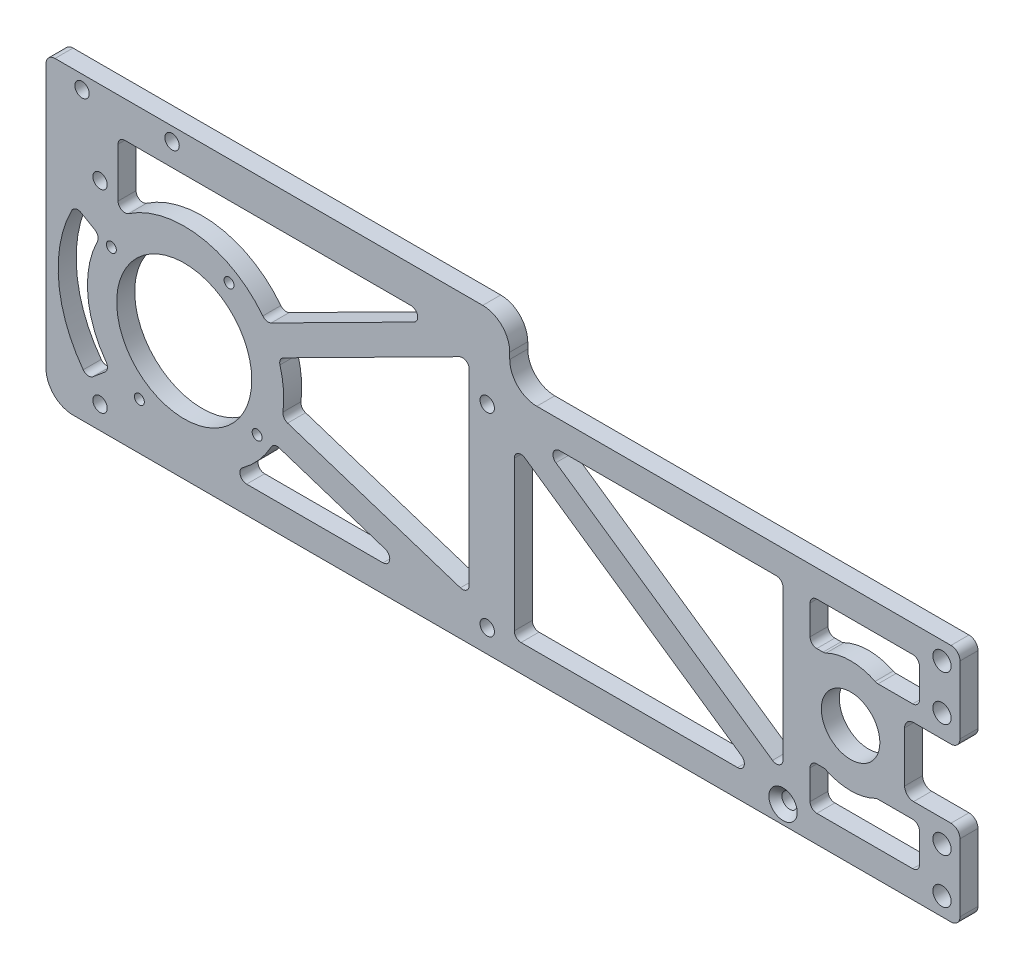
from build123d import *

# Parameters (mm, degrees)
SKETCH_1_W                   = 200
SKETCH_1_H                   = 53.2
SKETCH_1_R                   = 6.5
SKETCH_1_R_2                 = 2.025
EXTRUDE_1_DEPTH              = 2
SKETCH_2_R                   = 20
CUT_EXTRUDE_1_DEPTH          = 5
CUT_EXTRUDE_2_DEPTH          = 10
SKETCH_4_R                   = 1.1
CUT_EXTRUDE_3_DEPTH          = 10
SKETCH_5_W                   = 100
SKETCH_5_H                   = 13.4
SKETCH_5_R                   = 1.6
EXTRUDE_2_DEPTH              = 4
EXTRUDE_3_DEPTH              = 4
SKETCH_7_R                   = 1.1
SKETCH_7_R_2                 = 15
EXTRUDE_4_DEPTH              = 4
SKETCH_9_R                   = 1.1
CUT_EXTRUDE_4_DEPTH          = 10
SKETCH_11_R                  = 1.6
CUT_EXTRUDE_6_DEPTH          = 4
FILLET_1_R                   = 6
SKETCH_17_W                  = 12.3
SKETCH_17_H                  = 15.2
CUT_EXTRUDE_9_DEPTH          = 4
CUT_EXTRUDE_10_DEPTH         = 4
CUT_EXTRUDE_11_DEPTH         = 4
FILLET_2_R                   = 1.5
CUT_EXTRUDE_12_DEPTH         = 4
FILLET_3_R                   = 1.5
SKETCH_21_R                  = 1.55
CUT_EXTRUDE_13_DEPTH         = 10
FILLET_4_R                   = 2
HOLE_WIZARD_M3_1_D           = 3.4
HOLE_WIZARD_M3_1_CSINK_D     = 6.3
HOLE_WIZARD_M3_1_CSINK_ANGLE = 90


with BuildPart() as part:
    # 草图1 → 凸台-拉伸1 (new, symmetric)
    with BuildSketch(Plane.XY):
        with Locations((-75.7, 0)):
            Rectangle(SKETCH_1_W, SKETCH_1_H)
        Circle(SKETCH_1_R, mode=Mode.SUBTRACT)
        with Locations((20.3, 22.6)):
            Circle(SKETCH_1_R_2, mode=Mode.SUBTRACT)
        with Locations((20.3, 12.6)):
            Circle(SKETCH_1_R_2, mode=Mode.SUBTRACT)
        with Locations((20.3, -12.6)):
            Circle(SKETCH_1_R_2, mode=Mode.SUBTRACT)
        with Locations((20.3, -22.6)):
            Circle(SKETCH_1_R_2, mode=Mode.SUBTRACT)
    extrude(amount=EXTRUDE_1_DEPTH, both=True)

    # 草图2 → 切除-拉伸1 (cut)
    with BuildSketch(Plane.XY.offset(2)):
        with Locations((-148, 0)):
            Circle(SKETCH_2_R)
    extrude(amount=-CUT_EXTRUDE_1_DEPTH, mode=Mode.SUBTRACT)

    # 草图3 → 切除-拉伸2 (cut)
    with BuildSketch(Plane.XY.offset(2)):
        with BuildLine():
            Line((-136.21195189, -26.6), (-139.272801212, -12.199836119))
            ThreePointArc((-139.272801212, -12.199836119), (-152.260230171, -14.382296023), (-161.963751735, -5.47847036))
            Line((-161.963751735, -5.47847036), (-175.7, -19.214718626))
            Line((-175.7, -19.214718626), (-175.7, -26.6))
            Line((-175.7, -26.6), (-136.21195189, -26.6))
        make_face()
    extrude(amount=-CUT_EXTRUDE_2_DEPTH, mode=Mode.SUBTRACT)

    # 草图4 → 切除-拉伸3 (cut)
    with BuildSketch(Plane.XY.offset(2)):
        with Locations((-141, 23.478713764)):
            Circle(SKETCH_4_R)
        with Locations((-131.166837432, -17.801534708)):
            Circle(SKETCH_4_R)
        with Locations((-171.833162568, -5.677179055)):
            Circle(SKETCH_4_R)
    extrude(amount=-CUT_EXTRUDE_3_DEPTH, mode=Mode.SUBTRACT)

    # 草图5 → 凸台-拉伸2 (add)
    with BuildSketch(Plane.XY.offset(2)):
        with Locations((-125.7, 33.3)):
            Rectangle(SKETCH_5_W, SKETCH_5_H)
        with Locations((-170.7, 37)):
            Circle(SKETCH_5_R, mode=Mode.SUBTRACT)
        with Locations((-150.7, 37)):
            Circle(SKETCH_5_R, mode=Mode.SUBTRACT)
    extrude(amount=-EXTRUDE_2_DEPTH)

    # 草图6 → 凸台-拉伸3 (add)
    with BuildSketch(Plane.XY.offset(2)):
        Polygon((-175.7, 40), (-178.7, 40), (-178.7, -22.214718626), (-175.7, -19.214718626), align=None)
    extrude(amount=-EXTRUDE_3_DEPTH)

    # 草图7 → 凸台-拉伸4 (add)
    # profile 1 of 4: a face of its own
    with BuildSketch(Plane.XY.offset(2)):
        with Locations((-141, 23.478713764)):
            Circle(SKETCH_7_R)
    # profile 2 of 4: a face of its own
    with BuildSketch(Plane.XY.offset(2)):
        with Locations((-171.833162568, -5.677179055)):
            Circle(SKETCH_7_R)
    # profile 3 of 4: a face of its own
    with BuildSketch(Plane.XY.offset(2)):
        with Locations((-131.166837432, -17.801534708)):
            Circle(SKETCH_7_R)
    # profile 4 of 4: a face of its own
    with BuildSketch(Plane.XY.offset(2)):
        with BuildLine():
            Line((-136.21195189, -26.6), (-178.7, -26.6))
            Line((-178.7, -26.6), (-178.7, -22.214718626))
            Line((-178.7, -22.214718626), (-165.73337825, -9.248096876))
            ThreePointArc((-165.73337825, -9.248096876), (-142.319693106, 19.176394697), (-138.16441215, -17.414396677))
            Line((-138.16441215, -17.414396677), (-136.21195189, -26.6))
        make_face()
        with Locations((-148, 0)):
            Circle(SKETCH_7_R_2, mode=Mode.SUBTRACT)
    extrude(amount=-EXTRUDE_4_DEPTH)

    # 草图9 → 切除-拉伸4 (cut)
    with BuildSketch(Plane.XY.offset(2)):
        with Locations((-138.043830116, 16.182542484)):
            Circle(SKETCH_9_R)
        with Locations((-164.182542484, 9.956169884)):
            Circle(SKETCH_9_R)
        with Locations((-157.956169884, -16.182542484)):
            Circle(SKETCH_9_R)
        with Locations((-131.817457516, -9.956169884)):
            Circle(SKETCH_9_R)
    extrude(amount=-CUT_EXTRUDE_4_DEPTH, mode=Mode.SUBTRACT)

    # 草图11 → 切除-拉伸6 (cut)
    with BuildSketch(Plane.XY.offset(2)):
        with Locations((-166.7, 21.5)):
            Circle(SKETCH_11_R)
        with Locations((-80.7, 21.5)):
            Circle(SKETCH_11_R)
        with Locations((-166.7, -21.5)):
            Circle(SKETCH_11_R)
        with Locations((-80.7, -21.5)):
            Circle(SKETCH_11_R)
    extrude(amount=-CUT_EXTRUDE_6_DEPTH, mode=Mode.SUBTRACT)

    # 圆角1
    fillet_1_edges = [part.edges().sort_by_distance(p)[0] for p in [
        (-178.7, -26.6, 0),
        (-75.7, 40, 0),
        (-75.7, 26.6, 0),
    ]]
    fillet(fillet_1_edges, radius=FILLET_1_R)

    # 草图17 → 切除-拉伸9 (cut)
    with BuildSketch(Plane.XY.offset(2)):
        with Locations((18.15, 0)):
            Rectangle(SKETCH_17_W, SKETCH_17_H)
        with BuildLine():
            Line((15.3, -11.1), (5.748043145, -11.1))
            ThreePointArc((5.748043145, -11.1), (0, -12.5), (-5.748043145, -11.1))
            Line((-5.748043145, -11.1), (-9, -11.1))
            Line((-9, -11.1), (-9, -20.6))
            Line((-9, -20.6), (15.3, -20.6))
            Line((15.3, -20.6), (15.3, -11.1))
        make_face()
        with BuildLine():
            ThreePointArc((-5.748043145, 11.1), (0, 12.5), (5.748043145, 11.1))
            Line((5.748043145, 11.1), (15.3, 11.1))
            Line((15.3, 11.1), (15.3, 20.6))
            Line((15.3, 20.6), (-9, 20.6))
            Line((-9, 20.6), (-9, 11.1))
            Line((-9, 11.1), (-5.748043145, 11.1))
        make_face()
    extrude(amount=-CUT_EXTRUDE_9_DEPTH, mode=Mode.SUBTRACT)

    # 草图18 → 切除-拉伸10 (cut)
    with BuildSketch(Plane.XY.offset(2)):
        Polygon((-20.281777038, -20.6), (-74.7, 16.95495454), (-74.7, -20.6), align=None)
        Polygon((-15, 20.6), (-69.418222962, 20.6), (-15, -16.95495454), align=None)
    extrude(amount=-CUT_EXTRUDE_10_DEPTH, mode=Mode.SUBTRACT)

    # 草图19 → 切除-拉伸11 (cut)
    with BuildSketch(Plane.XY.offset(2)):
        with BuildLine():
            Line((-139.99687561, -20.6), (-94.394315744, -20.6))
            Line((-94.394315744, -20.6), (-128.107736542, -9.62849181))
            ThreePointArc((-128.107736542, -9.62849181), (-133.012282903, -16.241254145), (-139.99687561, -20.6))
        make_face()
        with BuildLine():
            Line((-126.250978368, -3.92301645), (-84.7, -17.445135792))
            Line((-84.7, -17.445135792), (-84.7, 28.638447058))
            Line((-84.7, 28.638447058), (-127.106066696, 7.200940987))
            ThreePointArc((-127.106066696, 7.200940987), (-126.203602063, 3.650621453), (-125.9, 0))
            ThreePointArc((-125.9, 0), (-125.987919475, -1.969342776), (-126.250978368, -3.92301645))
        make_face()
        with BuildLine():
            Line((-162.7, 32), (-162.7, 16.502121076))
            ThreePointArc((-162.7, 16.502121076), (-145.366842593, 21.942572367), (-129.81300787, 12.555608996))
            Line((-129.81300787, 12.555608996), (-91.349571914, 32))
            Line((-91.349571914, 32), (-162.7, 32))
        make_face()
    extrude(amount=-CUT_EXTRUDE_11_DEPTH, mode=Mode.SUBTRACT)

    # 圆角2
    fillet_2_edges = [part.edges().sort_by_distance(p)[0] for p in [
        (-5.748043145, -11.1, 0),
        (5.748043145, -11.1, 0),
        (15.3, -11.1, 0),
        (15.3, -20.6, 0),
        (-9, -20.6, 0),
        (-9, -11.1, 0),
        (5.748043145, 11.1, 0),
        (-5.748043145, 11.1, 0),
        (-9, 11.1, 0),
        (-9, 20.6, 0),
        (15.3, 20.6, 0),
        (15.3, 11.1, 0),
        (-69.418222962, 20.6, 0),
        (-15, 20.6, 0),
        (-15, -16.95495454, 0),
        (-20.281777038, -20.6, 0),
        (-74.7, -20.6, 0),
        (-74.7, 16.95495454, 0),
        (-126.250978368, -3.92301645, 0),
        (-127.106066696, 7.200940987, 0),
        (-84.7, 28.638447058, 0),
        (-84.7, -17.445135792, 0),
        (-129.81300787, 12.555608996, 0),
        (-162.7, 16.502121076, 0),
        (-162.7, 32, 0),
        (-91.349571914, 32, 0),
        (-139.99687561, -20.6, 0),
        (-128.107736542, -9.62849181, 0),
        (-94.394315744, -20.6, 0),
    ]]
    fillet(fillet_2_edges, radius=FILLET_2_R)

    # 草图20 → 切除-拉伸12 (cut)
    with BuildSketch(Plane.XY.offset(2)):
        with BuildLine():
            Line((-169.449244407, -17.998053071), (-164.469955527, -13.819933608))
            ThreePointArc((-164.469955527, -13.819933608), (-168.203391347, -7.353433082), (-169.5, 0))
            Line((-169.5, 0), (-176, 0))
            ThreePointArc((-176, 0), (-174.311393382, -9.576564013), (-169.449244407, -17.998053071))
        make_face()
        with BuildLine():
            ThreePointArc((-169.5, 0), (-168.767405265, 5.56460947), (-166.619546181, 10.75))
            Line((-166.619546181, 10.75), (-172.248711306, 14))
            ThreePointArc((-172.248711306, 14), (-175.045923136, 7.246933263), (-176, 0))
            Line((-176, 0), (-169.5, 0))
        make_face()
    extrude(amount=-CUT_EXTRUDE_12_DEPTH, mode=Mode.SUBTRACT)

    # 圆角3
    fillet_3_edges = [part.edges().sort_by_distance(p)[0] for p in [
        (-166.619546181, 10.75, 0),
        (-164.469955527, -13.819933608, 0),
        (-169.449244407, -17.998053071, 0),
        (-172.248711306, 14, 0),
    ]]
    fillet(fillet_3_edges, radius=FILLET_3_R)

    # 草图21 → 切除-拉伸13 (cut)
    with BuildSketch(Plane.XY.offset(2)):
        with Locations((-15, -22.6)):
            Circle(SKETCH_21_R)
    extrude(amount=-CUT_EXTRUDE_13_DEPTH, mode=Mode.SUBTRACT)

    # 圆角4
    fillet_4_edges = [part.edges().sort_by_distance(p)[0] for p in [
        (-178.7, 40, 0),
        (12, 7.6, 0),
        (24.3, 7.6, 0),
        (24.3, -7.6, 0),
        (12, -7.6, 0),
        (24.3, 26.6, 0),
        (24.3, -26.6, 0),
    ]]
    fillet(fillet_4_edges, radius=FILLET_4_R)

    # M3 锥坑平头螺钉的锥形沉头孔1 (through all)
    with Locations(Plane.XY.offset(2)):
        with Locations((-15, -22.6)):
            CounterSinkHole(HOLE_WIZARD_M3_1_D / 2, HOLE_WIZARD_M3_1_CSINK_D / 2, counter_sink_angle=HOLE_WIZARD_M3_1_CSINK_ANGLE)


solid = part.part
